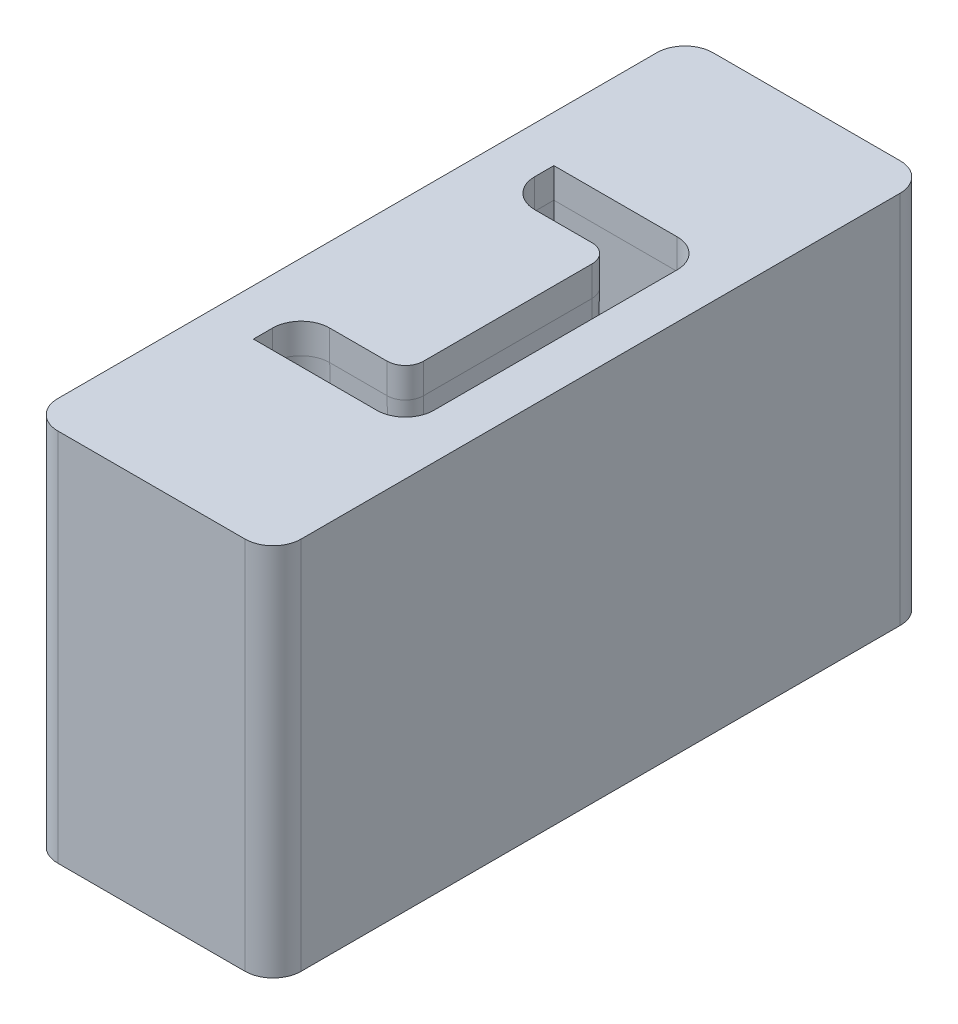
from build123d import *

# Parameters (mm, degrees)
SKETCH1_W             = 26
SKETCH1_H             = 70
BOSS_EXTRUDE1_DEPTH   = 40
FILLET1_R             = 3
CUT_EXTRUDE1_REACH    = 56.717
M8_TAPPED_HOLE1_D     = 6.8
M8_TAPPED_HOLE1_DEPTH = 22.25
M8_TAPPED_HOLE1_TIP   = 2.042926105


with BuildPart() as part:
    # Sketch1 → Boss-Extrude1 (new body)
    with BuildSketch(Plane(origin=(0, 0, 0), x_dir=(1, 0, 0), z_dir=(0, 1, 0))):
        Rectangle(SKETCH1_W, SKETCH1_H)
    extrude(amount=-BOSS_EXTRUDE1_DEPTH)

    # Fillet1
    fillet1_edges = [part.edges().sort_by_distance(p)[0] for p in [
        (13, -20, 35),
        (-13, -20, 35),
        (-13, -20, -35),
        (13, -20, -35),
    ]]
    fillet(fillet1_edges, radius=FILLET1_R)

    # Sketch9 → Cut-Extrude1 (cut, up to next)
    with BuildSketch(Plane(origin=(0, 0, 0), x_dir=(1, 0, 0), z_dir=(0, 1, 0)), mode=Mode.PRIVATE) as cut_extrude1_sk1:
        with BuildLine():
            Line((3.08, 9), (3.08, -9))
            ThreePointArc((3.08, -9), (2.508858223, -10.378858223), (1.13, -10.95))
            Line((1.13, -10.95), (-5, -10.95))
            ThreePointArc((-5, -10.95), (-7.156675683, -11.843324317), (-8.05, -14))
            Line((-8.05, -14), (-8.05, -16.05))
            Line((-8.05, -16.05), (5.13, -16.05))
            ThreePointArc((5.13, -16.05), (7.286675683, -15.156675683), (8.18, -13))
            Line((8.18, -13), (8.18, 13))
            ThreePointArc((8.18, 13), (7.286675683, 15.156675683), (5.13, 16.05))
            Line((5.13, 16.05), (-8.05, 16.05))
            Line((-8.05, 16.05), (-8.05, 14))
            ThreePointArc((-8.05, 14), (-7.156675683, 11.843324317), (-5, 10.95))
            Line((-5, 10.95), (1.13, 10.95))
            ThreePointArc((1.13, 10.95), (2.508858223, 10.378858223), (3.08, 9))
        make_face()
    cut_extrude1_tool1 = extrude(cut_extrude1_sk1.sketch, amount=-CUT_EXTRUDE1_REACH, mode=Mode.PRIVATE) & part.part
    add(cut_extrude1_tool1.solids().sort_by_distance((3.439697, 0, 0))[0], mode=Mode.SUBTRACT)

    # Cut-Sweep1: sweep along a path in Sketch12
    with BuildLine(Plane(origin=(0, 0, 0), x_dir=(1, 0, 0), z_dir=(0, 1, 0))) as cut_sweep1_path:
        Line((-8.05, -14), (-8.05, -16.05))
        Line((-8.05, -16.05), (5.13, -16.05))
        ThreePointArc((5.13, -16.05), (7.286675683, -15.156675683), (8.18, -13))
        Line((8.18, -13), (8.18, 13))
        ThreePointArc((8.18, 13), (7.286675683, 15.156675683), (5.13, 16.05))
        Line((5.13, 16.05), (-8.05, 16.05))
        Line((-8.05, 16.05), (-8.05, 14))
        ThreePointArc((-8.05, 14), (-7.156675683, 11.843324317), (-5, 10.95))
        Line((-5, 10.95), (1.13, 10.95))
        ThreePointArc((1.13, 10.95), (2.508858223, 10.378858223), (3.08, 9))
        Line((3.08, 9), (3.08, -9))
        ThreePointArc((3.08, -9), (2.508858223, -10.378858223), (1.13, -10.95))
        Line((1.13, -10.95), (-5, -10.95))
        ThreePointArc((-5, -10.95), (-7.156675683, -11.843324317), (-8.05, -14))
    # Sketch11 → Cut-Sweep1 (sweep, cut)
    with BuildSketch(Plane.XY):
        Polygon((8.18, -3.2), (8.822346389, -40), (8.18, -40), align=None)
    sweep(path=cut_sweep1_path.line, transition=Transition.RIGHT, mode=Mode.SUBTRACT)

    # M8 Tapped Hole1
    with Locations(Plane(origin=(0, -40, 0), x_dir=(-1, 0, 0), z_dir=(0, -1, 0))):
        with Locations((0, -25.846173195), (0, 25.846173195)):
            Hole(M8_TAPPED_HOLE1_D / 2, depth=M8_TAPPED_HOLE1_DEPTH)
            with Locations((0, 0, -(M8_TAPPED_HOLE1_DEPTH + M8_TAPPED_HOLE1_TIP / 2))):  # 118° drill point
                Cone(0, M8_TAPPED_HOLE1_D / 2, M8_TAPPED_HOLE1_TIP, mode=Mode.SUBTRACT)


solid = part.part
